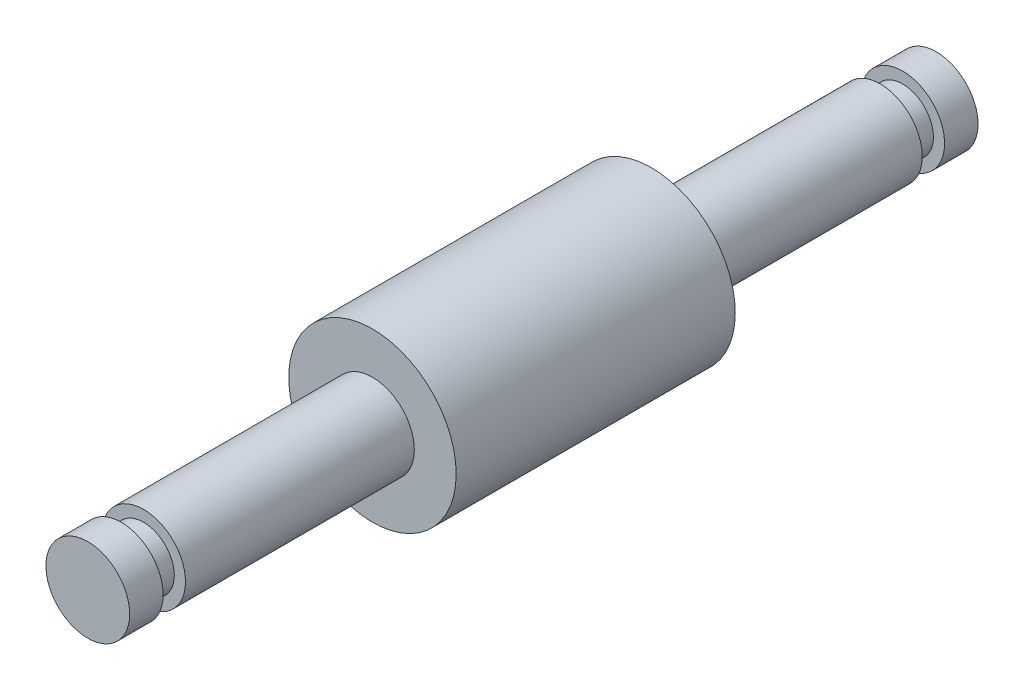
from build123d import *

# Parameters (mm, degrees)
IZIM1_R                     = 15
Y_KSEKLIK_EKSTR_ZYON1_DEPTH = 25
IZIM2_R                     = 7.5
Y_KSEKLIK_EKSTR_ZYON2_DEPTH = 41
IZIM3_R                     = 5.5
Y_KSEKLIK_EKSTR_ZYON3_DEPTH = 4
IZIM4_R                     = 7.5
Y_KSEKLIK_EKSTR_ZYON4_DEPTH = 6
Y_KSEKLIK_EKSTR_ZYON5_START = 41
IZIM6_R                     = 7.5
Y_KSEKLIK_EKSTR_ZYON5_DEPTH = 41
Y_KSEKLIK_EKSTR_ZYON6_START = 4
IZIM7_R                     = 5.5
Y_KSEKLIK_EKSTR_ZYON6_DEPTH = 4
Y_KSEKLIK_EKSTR_ZYON7_START = 6
IZIM8_R                     = 7.5
Y_KSEKLIK_EKSTR_ZYON7_DEPTH = 6


with BuildPart() as part:
    # Çizim1 → Yükseklik-Ekstrüzyon1 (new, symmetric)
    with BuildSketch(Plane.XY):
        Circle(IZIM1_R)
    extrude(amount=Y_KSEKLIK_EKSTR_ZYON1_DEPTH, both=True)

    # Çizim2 → Yükseklik-Ekstrüzyon2 (add)
    with BuildSketch(Plane.XY.offset(25)):
        Circle(IZIM2_R)
    extrude(amount=Y_KSEKLIK_EKSTR_ZYON2_DEPTH)

    # Çizim3 → Yükseklik-Ekstrüzyon3 (add)
    with BuildSketch(Plane.XY.offset(66)):
        Circle(IZIM3_R)
    extrude(amount=Y_KSEKLIK_EKSTR_ZYON3_DEPTH)

    # Çizim4 → Yükseklik-Ekstrüzyon4 (add)
    with BuildSketch(Plane.XY.offset(70)):
        Circle(IZIM4_R)
    extrude(amount=Y_KSEKLIK_EKSTR_ZYON4_DEPTH)

    # Çizim6 → Yükseklik-Ekstrüzyon5 (add)
    with BuildSketch(Plane(origin=(0, 0, -25), x_dir=(-1, 0, 0), z_dir=(0, 0, -1)).offset(Y_KSEKLIK_EKSTR_ZYON5_START)):
        with Locations(Location((0, 0, 0), (0, 0, 180))):
            Circle(IZIM6_R)
    extrude(amount=-Y_KSEKLIK_EKSTR_ZYON5_DEPTH)

    # Çizim7 → Yükseklik-Ekstrüzyon6 (add)
    with BuildSketch(Plane(origin=(0, 0, -66), x_dir=(-1, 0, 0), z_dir=(0, 0, -1)).offset(Y_KSEKLIK_EKSTR_ZYON6_START)):
        with Locations(Location((0, 0, 0), (0, 0, 180))):
            Circle(IZIM7_R)
    extrude(amount=-Y_KSEKLIK_EKSTR_ZYON6_DEPTH)

    # Çizim8 → Yükseklik-Ekstrüzyon7 (add)
    with BuildSketch(Plane(origin=(0, 0, -70), x_dir=(-1, 0, 0), z_dir=(0, 0, -1)).offset(Y_KSEKLIK_EKSTR_ZYON7_START)):
        with Locations(Location((0, 0, 0), (0, 0, 180))):
            Circle(IZIM8_R)
    extrude(amount=-Y_KSEKLIK_EKSTR_ZYON7_DEPTH)


solid = part.part
